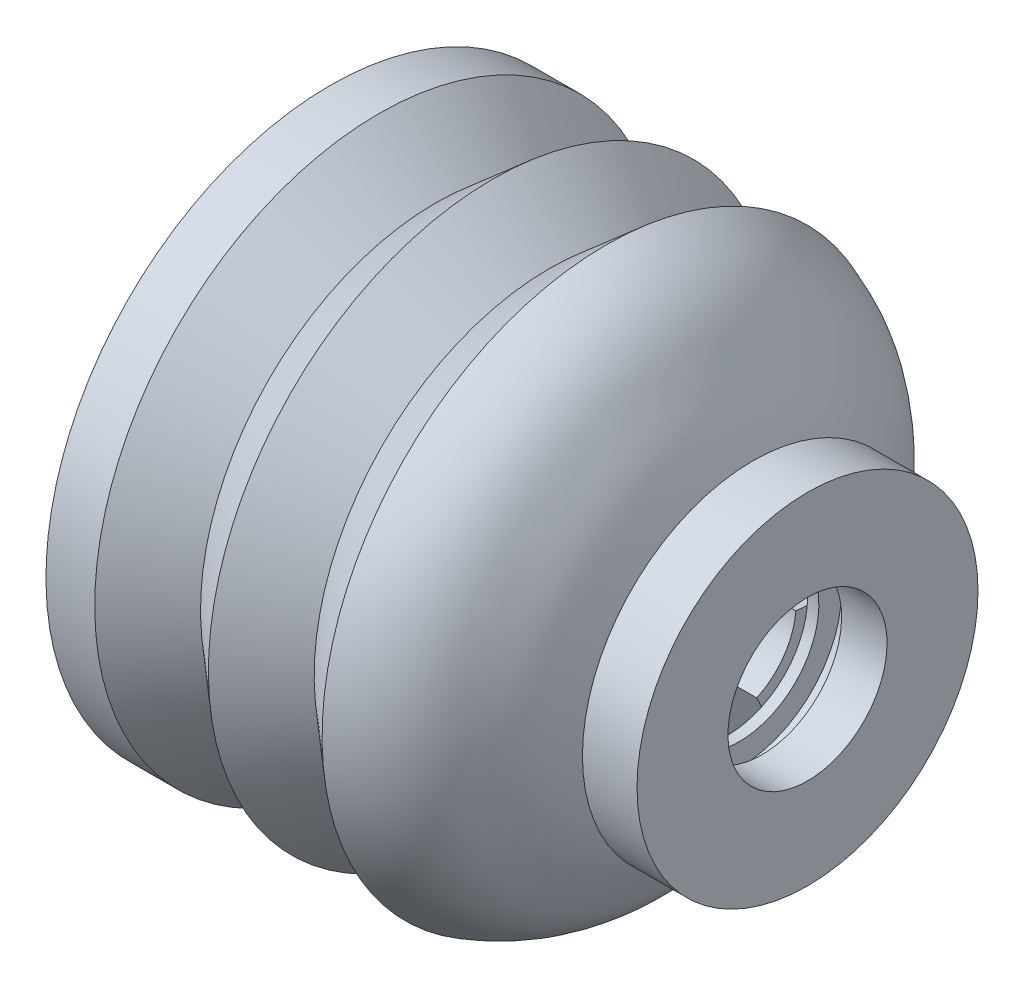
from build123d import *

# Parameters (mm, degrees)
REVOLVE_4_ANGLE          = 60
PATTERN_CIRCULAR_1_COUNT = 4


with BuildPart() as part:
    # 草图1 → 旋转2 (revolve)
    with BuildSketch(Plane.XY, mode=Mode.PRIVATE) as revolve_2_sk:
        with BuildLine():
            Line((-4.981080731, -19.736358929), (-8.981080731, -19.736358929))
            Line((-8.981080731, -19.736358929), (-8.981080731, -21.736358929))
            Line((-8.981080731, -21.736358929), (-10.981080731, -21.736358929))
            Line((-10.981080731, -21.736358929), (-10.981080731, -19.736358929))
            Line((-10.981080731, -19.736358929), (-11.981080731, -19.736358929))
            add(Edge.make_bspline(
                [(-11.981080731, -19.736358929), (-14.105079515, -29.836776521), (-22.689787766, -34.041464812)],
                knots=[0, 0, 0, 1, 1, 1], degree=2))
            Line((-22.689787766, -34.041464812), (-26.167714154, -31.046896542))
            ThreePointArc((-26.167714154, -31.046896542), (-27.689787766, -30.481913457), (-29.211861379, -31.046896542))
            Line((-29.211861379, -31.046896542), (-32.689787766, -34.041464812))
            Line((-32.689787766, -34.041464812), (-36.167714154, -31.046896542))
            ThreePointArc((-36.167714154, -31.046896542), (-37.689787766, -30.481913457), (-39.211861379, -31.046896542))
            Line((-39.211861379, -31.046896542), (-46.981080731, -37.736358929))
            Line((-46.981080731, -37.736358929), (-42.689787766, -37.736358929))
            Line((-42.689787766, -37.736358929), (-37.689787766, -33.431253046))
            Line((-37.689787766, -33.431253046), (-32.689787766, -37.736358929))
            Line((-32.689787766, -37.736358929), (-27.689787766, -33.431253046))
            Line((-27.689787766, -33.431253046), (-22.689787766, -37.736358929))
            add(Edge.make_bspline(
                [(-11.981080731, -23.536358929), (-13.218077622, -28.193488855), (-13.94983801, -29.242750421), (-17.443623259, -35.173249874), (-19.934832658, -36.815558997), (-22.689787766, -37.736358929)],
                knots=[0, 0, 0, 0, 0.485973614, 0.585973614, 1, 1, 1, 1], degree=3))
            Line((-11.981080731, -23.536358929), (-9.781080731, -27.736358929))
            Line((-9.781080731, -27.736358929), (-4.981080731, -27.736358929))
            Line((-4.981080731, -27.736358929), (-4.981080731, -19.736358929))
        make_face()
    revolve(revolve_2_sk.sketch.rotate(Axis((7.759097512, -12.736358929, 0), (-1, 0, 0)), 180), axis=Axis((7.759097512, -12.736358929, 0), (-1, 0, 0)))


with BuildPart() as body_2:
    # 草图3 → 旋转4 (revolve)
    with BuildSketch(Plane(origin=(0, -12.639611974, 1.105822759), x_dir=(1, 0, 0), z_dir=(0, -0.9961946980917459, 0.08715574274765504))):
        with BuildLine():
            Line((-11.981080731, -8.768373779), (-11.981080731, -7.110046822))
            Line((-11.981080731, -7.110046822), (-18.981080731, -7.110046822))
            Line((-18.981080731, -7.110046822), (-18.981080731, -21.291174479))
            add(Edge.make_bspline(
                [(-11.981080731, -8.768373779), (-12.626813815, -12.193567325), (-14.690315158, -16.799816788), (-17.609024266, -20.330987822), (-18.981080731, -21.291174479)],
                knots=[0, 0, 0, 0, 0.528344687, 0.796807345, 0.796807345, 0.796807345, 0.796807345], degree=3))
        make_face()
    revolve(axis=Axis((-4.981080731, -12.736358929, 0), (-1, 0, 0)), revolution_arc=REVOLVE_4_ANGLE)


with BuildPart() as pattern_circular_1_1:
    # 阵列(圆周)1: pattern copy
    add(body_2.part.rotate(Axis((-56.121874835, -12.736358929, 0), (1, 0, 0)), 1 * 360 / PATTERN_CIRCULAR_1_COUNT))


with BuildPart() as pattern_circular_1_2:
    # 阵列(圆周)1: pattern copy
    add(body_2.part.rotate(Axis((-56.121874835, -12.736358929, 0), (1, 0, 0)), 2 * 360 / PATTERN_CIRCULAR_1_COUNT))


with BuildPart() as pattern_circular_1_3:
    # 阵列(圆周)1: pattern copy
    add(body_2.part.rotate(Axis((-56.121874835, -12.736358929, 0), (1, 0, 0)), 3 * 360 / PATTERN_CIRCULAR_1_COUNT))


with BuildPart() as part_1:
    add(part.part)

    # Combine 1: union 阵列(圆周)1_1, body 2, 阵列(圆周)1_2, 阵列(圆周)1_3
    add(pattern_circular_1_1.part)
    add(body_2.part)
    add(pattern_circular_1_2.part)
    add(pattern_circular_1_3.part)

    # 草图5 → 旋转5 (revolve)
    with BuildSketch(Plane(origin=(0, -12.639611974, 1.105822759), x_dir=(1, 0, 0), z_dir=(0, -0.9961946980917459, 0.08715574274765475))):
        with BuildLine():
            Line((-14.981080731, 4.889953178), (-17.481080731, 4.889953178))
            add(Edge.make_bspline(
                [(-14.981080731, 4.889953178), (-16.231080731, 4.089953178), (-17.481080731, 4.889953178)],
                knots=[0, 0, 0, 1, 1, 1], degree=2))
        make_face()
    revolve(axis=Axis((-56.121874835, -12.736358929, 0), (1, 0, 0)))


solid = part_1.part
